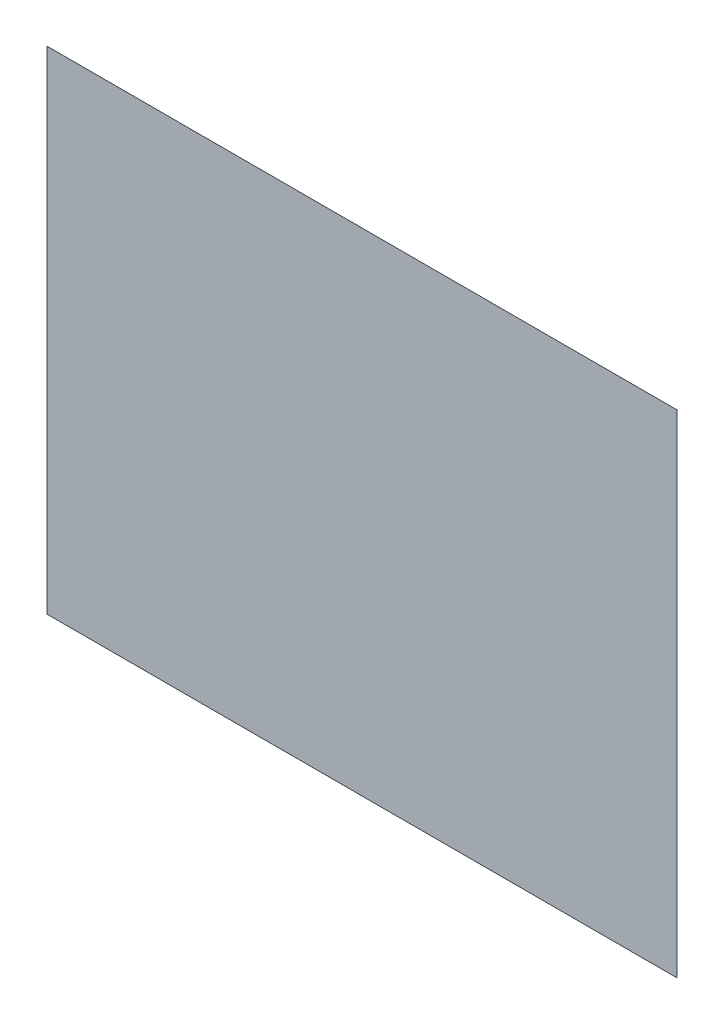
from build123d import *


with BuildPart() as part:
    # 草图2 → 放样1 section 0
    with BuildSketch(Plane.XY.offset(100)):
        with BuildLine():
            Line((-122.495603667, 226.396179637), (212.504396333, 226.396179637))
            Line((212.504396333, 226.396179637), (212.504396333, -35.003820363))
            Line((212.504396333, -35.003820363), (-122.495603667, -35.003820363))
            Line((-122.495603667, -35.003820363), (-122.495603667, 226.396179637))
        make_face()
    # 草图1 → 放样1 section 1
    with BuildSketch(Plane.XY):
        with BuildLine():
            Line((-22.495603667, 126.396179637), (112.504396333, 126.396179637))
            Line((112.504396333, 126.396179637), (112.504396333, 1.396179637))
            Line((112.504396333, 1.396179637), (-22.495603667, 1.396179637))
            Line((-22.495603667, 1.396179637), (-22.495603667, 126.396179637))
        make_face()
    loft()


solid = part.part
